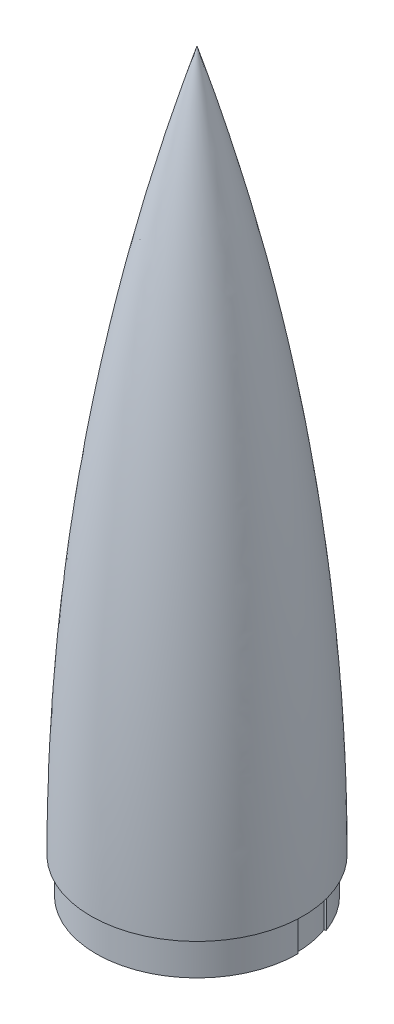
from build123d import *

# Parameters (mm, degrees)
SKETCH1_R           = 57
BOSS_EXTRUDE1_DEPTH = 20
CUT_EXTRUDE1_START  = -20
CUT_EXTRUDE1_DEPTH  = 20


with BuildPart() as part:
    # Sketch1 → Boss-Extrude1 (new body)
    with BuildSketch(Plane(origin=(0, 0, 0), x_dir=(1, 0, 0), z_dir=(0, 1, 0))):
        with Locations(Location((0, 0, 0), (0, 0, 270))):
            Circle(SKETCH1_R)
    extrude(amount=BOSS_EXTRUDE1_DEPTH)

    # Sketch2 → Cut-Extrude1 (cut)
    with BuildSketch(Plane(origin=(0, 20, 0), x_dir=(1, 0, 0), z_dir=(0, 1, 0)).offset(CUT_EXTRUDE1_START)):
        with BuildLine():
            Line((-57, 0), (-56, 0))
            ThreePointArc((-56, 0), (-55.149234169, -9.724297949), (-52.622786764, -19.153128026))
            Line((-52.622786764, -19.153128026), (-53.562479385, -19.49514817))
            ThreePointArc((-53.562479385, -19.49514817), (-56.134041922, -9.897946127), (-57, 0))
        make_face()
        with BuildLine():
            Line((52.622786764, 19.153128026), (53.562479385, 19.49514817))
            ThreePointArc((53.562479385, 19.49514817), (56.134041922, 9.897946127), (57, 0))
            Line((57, 0), (56, 0))
            ThreePointArc((56, 0), (55.149234169, 9.724297949), (52.622786764, 19.153128026))
        make_face()
    extrude(amount=CUT_EXTRUDE1_DEPTH, mode=Mode.SUBTRACT)

    # Sketch3 → Revolve1 (revolve)
    with BuildSketch(Plane.XY):
        with BuildLine():
            Line((0, 20), (60, 20))
            ThreePointArc((60, 20), (44.914851331, 220.21946252), (0, 415.918340932))
            Line((0, 415.918340932), (0, 20))
        make_face()
    revolve(axis=Axis((0, 415.918340932, 0), (0, -1, 0)))


solid = part.part
